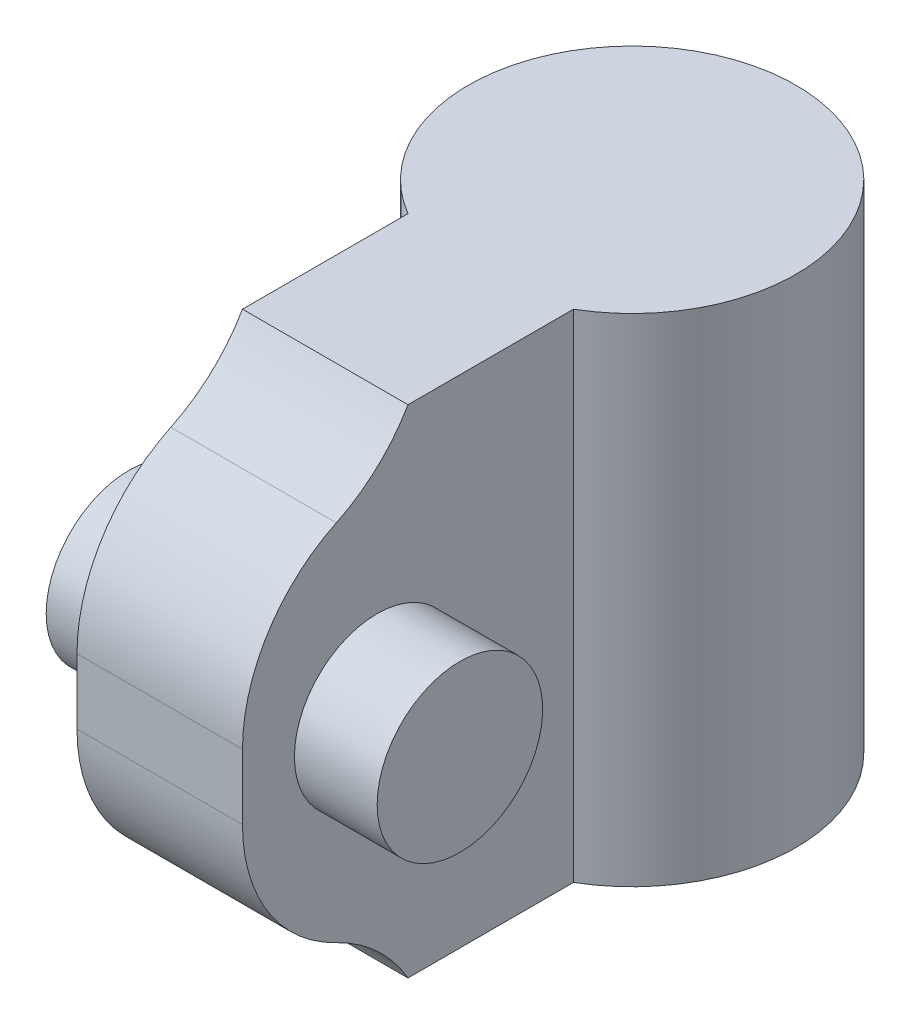
from build123d import *

# Parameters (mm, degrees)
BOSS_EXTRUDE1_DEPTH = 15
CUT_EXTRUDE1_DEPTH  = 23.004565192
CUT_EXTRUDE2_DEPTH  = 23.004565192
SKETCH4_W           = 2.5
SKETCH4_H           = 2.5
SKETCH5_W           = 2.5
SKETCH5_H           = 2.5


with BuildPart() as part:
    # Sketch1 → Boss-Extrude1 (new body)
    with BuildSketch(Plane.XZ.offset(15)):
        with BuildLine():
            Line((-2.5, 14.272294466), (-2.5, 4.272294466))
            ThreePointArc((-2.5, 4.272294466), (0, -4.95), (2.5, 4.272294466))
            Line((2.5, 4.272294466), (2.5, 14.272294466))
            Line((2.5, 14.272294466), (-2.5, 14.272294466))
        make_face()
    extrude(amount=-BOSS_EXTRUDE1_DEPTH)

    # Sketch2 → Cut-Extrude1 (cut, through all)
    with BuildSketch(Plane(origin=(2.5, 0, 0), x_dir=(0, 0, -1), z_dir=(1, 0, 0))):
        with BuildLine():
            Line((-14.272294466, -15), (-9.272294466, -15))
            ThreePointArc((-9.272294466, -15), (-10.203329527, -13.83309751), (-11.437357975, -12.993060906))
            ThreePointArc((-11.437357975, -12.993060906), (-13.504629374, -11.148327894), (-14.272294466, -8.486121811))
            Line((-14.272294466, -8.486121811), (-14.272294466, -15))
        make_face()
    extrude(amount=-CUT_EXTRUDE1_DEPTH, mode=Mode.SUBTRACT)

    # Sketch3 → Cut-Extrude2 (cut, through all)
    with BuildSketch(Plane(origin=(2.5, 0, 0), x_dir=(0, 0, -1), z_dir=(1, 0, 0))):
        with BuildLine():
            Line((-9.272294466, 0), (-14.272294466, 0))
            Line((-14.272294466, 0), (-14.272294466, -6.513878189))
            ThreePointArc((-14.272294466, -6.513878189), (-13.504629374, -3.851672106), (-11.437357975, -2.006939094))
            ThreePointArc((-11.437357975, -2.006939094), (-10.203329527, -1.16690249), (-9.272294466, 0))
        make_face()
    extrude(amount=-CUT_EXTRUDE2_DEPTH, mode=Mode.SUBTRACT)

    # Sketch4 → Revolve1 (revolve)
    with BuildSketch(Plane(origin=(0, 0, 10.203329527), x_dir=(-1, 0, 0), z_dir=(0, 0, -1)), mode=Mode.PRIVATE) as revolve1_sk:
        with Locations((3.75, -6.25)):
            Rectangle(SKETCH4_W, SKETCH4_H)
    revolve(revolve1_sk.sketch.rotate(Axis((-2.5, -7.5, 10.203329527), (-1, 0, 0)), 270), axis=Axis((-2.5, -7.5, 10.203329527), (-1, 0, 0)))

    # Sketch5 → Revolve2 (revolve)
    with BuildSketch(Plane(origin=(0, 0, 10.203329527), x_dir=(-1, 0, 0), z_dir=(0, 0, -1)), mode=Mode.PRIVATE) as revolve2_sk:
        with Locations((-3.75, -6.25)):
            Rectangle(SKETCH5_W, SKETCH5_H)
    revolve(revolve2_sk.sketch.rotate(Axis((5, -7.5, 10.203329527), (-1, 0, 0)), 270), axis=Axis((5, -7.5, 10.203329527), (-1, 0, 0)))


solid = part.part
